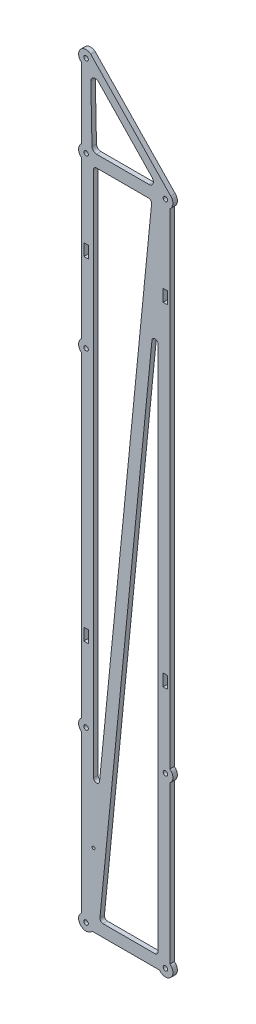
from build123d import *

# Parameters (mm, degrees)
SKETCH_1_R      = 1.5
SKETCH_1_R_2    = 1
SKETCH_1_W      = 3.04
SKETCH_1_H      = 8.04
EXTRUDE_1_DEPTH = 3


with BuildPart() as part:
    # 草图1 → 凸台-拉伸1 (new body)
    with BuildSketch(Plane.XY):
        with BuildLine():
            Line((56, -336.18), (56, -441))
            ThreePointArc((56, -441), (56.535533906, -448.535533906), (49, -448))
            Line((49, -448), (4, -448))
            ThreePointArc((4, -448), (-3.535533906, -448.535533906), (-3, -441))
            Line((-3, -441), (-3, -438.832903769))
            Line((-3, -438.832903769), (-3, -429.017949192))
            Line((-3, -429.017949192), (-3, -336.18))
            ThreePointArc((-3, -336.18), (-5, -332.18), (-3, -328.18))
            Line((-3, -328.18), (-3, -116.82))
            ThreePointArc((-3, -116.82), (-5, -112.82), (-3, -108.82))
            Line((-3, -108.82), (-3, -4))
            ThreePointArc((-3, -4), (-5, 0), (-3, 4))
            Line((-3, 4), (-3, 51))
            ThreePointArc((-3, 51), (-4, 58), (3, 59))
            Line((3, 59), (56.535533906, 3.535533906))
            ThreePointArc((56.535533906, 3.535533906), (57.987421044, -0.3544451), (56, -4))
            Line((56, -4), (56, -328.18))
            ThreePointArc((56, -328.18), (58, -332.18), (56, -336.18))
        make_face()
        Circle(SKETCH_1_R, mode=Mode.SUBTRACT)
        with Locations((0, -445)):
            Circle(SKETCH_1_R, mode=Mode.SUBTRACT)
        with Locations((0, -332.18)):
            Circle(SKETCH_1_R, mode=Mode.SUBTRACT)
        with Locations(Location((53, -332.18, 0), (0, 0, 180))):
            Circle(SKETCH_1_R, mode=Mode.SUBTRACT)
        with Locations(Location((53, -445, 0), (0, 0, 180))):
            Circle(SKETCH_1_R, mode=Mode.SUBTRACT)
        with Locations(Location((53, 0, 0), (0, 0, 180))):
            Circle(SKETCH_1_R, mode=Mode.SUBTRACT)
        with Locations((5, -399.337663182)):
            Circle(SKETCH_1_R_2, mode=Mode.SUBTRACT)
        with Locations((0, 55)):
            Circle(SKETCH_1_R, mode=Mode.SUBTRACT)
        with Locations((0, -112.82)):
            Circle(SKETCH_1_R, mode=Mode.SUBTRACT)
        with BuildLine():
            Line((6.938150971, 3), (41.969807465, 3))
            ThreePointArc((41.969807465, 3), (44.729078046, 4.822534134), (44.135772081, 8.07571609))
            Line((44.135772081, 8.07571609), (8.325634331, 45.44281635))
            ThreePointArc((8.325634331, 45.44281635), (5.012233456, 46.138993121), (3.160320545, 43.30461382))
            Line((3.160320545, 43.30461382), (3.938801801, 5.937513559))
            ThreePointArc((3.938801801, 5.937513559), (4.839039174, 3.85670122), (6.938150971, 3))
        make_face(mode=Mode.SUBTRACT)
        with BuildLine():
            Line((48, -86.226063366), (48, -438))
            ThreePointArc((48, -438), (47.414213562, -439.414213562), (46, -440))
            Line((46, -440), (11.226944195, -440))
            ThreePointArc((11.226944195, -440), (9.744803089, -439.342854326), (9.236644598, -437.803257741))
            Line((9.236644598, -437.803257741), (44.009700404, -86.029321107))
            ThreePointArc((44.009700404, -86.029321107), (46.098490627, -84.228489939), (48, -86.226063366))
        make_face(mode=Mode.SUBTRACT)
        with BuildLine():
            Line((43.763355402, -7.196742259), (8.990299596, -358.970678893))
            ThreePointArc((8.990299596, -358.970678893), (6.901509373, -360.771510061), (5, -358.773936634))
            Line((5, -358.773936634), (5, -7))
            ThreePointArc((5, -7), (5.585786438, -5.585786438), (7, -5))
            Line((7, -5), (41.773055805, -5))
            ThreePointArc((41.773055805, -5), (43.255196911, -5.657145674), (43.763355402, -7.196742259))
        make_face(mode=Mode.SUBTRACT)
        with Locations((53, -56.41)):
            Rectangle(SKETCH_1_W, SKETCH_1_H, mode=Mode.SUBTRACT)
        with Locations((0, -56.41)):
            Rectangle(SKETCH_1_W, SKETCH_1_H, mode=Mode.SUBTRACT)
        with Locations((53, -278.91)):
            Rectangle(SKETCH_1_W, SKETCH_1_H, mode=Mode.SUBTRACT)
        with Locations((0, -278.91)):
            Rectangle(SKETCH_1_W, SKETCH_1_H, mode=Mode.SUBTRACT)
    extrude(amount=EXTRUDE_1_DEPTH)


solid = part.part
